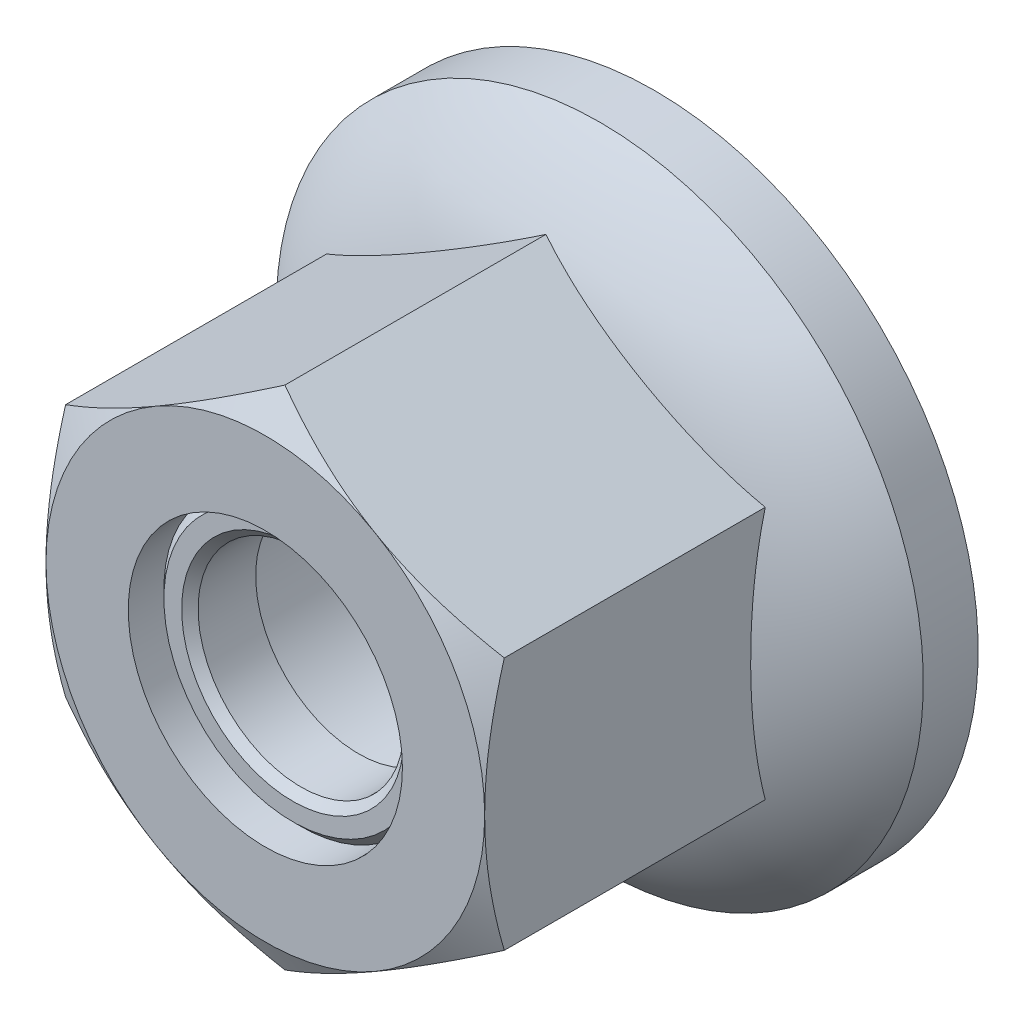
from build123d import *

# Parameters (mm, degrees)
SKETCH1_R           = 2.5
EXTRUDE1_DEPTH      = 7.1
SKETCH2_OUTSIDE_W   = 48.74
SKETCH2_OUTSIDE_H   = 49.978
SKETCH2_OUTSIDE_R   = 4
CUT_EXTRUDE1_DEPTH  = 10.36714115
CUT_EXTRUDE1_DRAFT  = -60
BOSS_EXTRUDE1_START = -0.5
SKETCH10_R          = 2.5
SKETCH10_R_2        = 1.876461709
BOSS_EXTRUDE1_DEPTH = 1.2
CHAMFER1_SIZE       = 0.15


with BuildPart() as part:
    # Sketch1 → Extrude1 (new body)
    with BuildSketch(Plane.XY):
        Polygon((0, 4.618802154), (-4, 2.309401077), (-4, -2.309401077), (0, -4.618802154), (4, -2.309401077), (4, 2.309401077), align=None)
        Circle(SKETCH1_R, mode=Mode.SUBTRACT)
    extrude(amount=-EXTRUDE1_DEPTH)


with BuildPart() as cut_extrude1_tool:
    # Sketch2 outside → Cut-Extrude1 (with draft: the straight prism first)
    with BuildSketch(Plane.XY):
        Rectangle(SKETCH2_OUTSIDE_W, SKETCH2_OUTSIDE_H)
        Circle(SKETCH2_OUTSIDE_R, mode=Mode.SUBTRACT)
    extrude(amount=-CUT_EXTRUDE1_DEPTH)
    # Cut-Extrude1: the draft: its side faces are tilted about the plane it starts from
    cut_extrude1_sides = [cut_extrude1_tool.faces().sort_by_distance(p)[0] for p in [
        (0, -24.989, -5.183570575),
        (24.37, 0, -5.183570575),
        (0, 24.989, -5.183570575),
        (-24.37, 0, -5.183570575),
        (-4, 0, -5.183570575),
    ]]
    draft(cut_extrude1_sides, Plane.XY, CUT_EXTRUDE1_DRAFT)


with BuildPart() as part_1:
    add(part.part)

    # Cut-Extrude1: cut by cut_extrude1_tool
    add(cut_extrude1_tool.part, mode=Mode.SUBTRACT)

    # Sketch3 → Revolve1 (revolve)
    with BuildSketch(Plane(origin=(0, 0, 0), x_dir=(0, 0, -1), z_dir=(1, 0, 0))):
        with BuildLine():
            Line((7.1, 5.9), (7.1, 2.5))
            Line((7.1, 2.5), (4.6, 2.5))
            ThreePointArc((4.6, 2.5), (4.99166172, 4.358090418), (6.1, 5.9))
            Line((6.1, 5.9), (7.1, 5.9))
        make_face()
    revolve(axis=Axis((0, 0, 0), (0, 0, -1)))


with BuildPart() as body_2:
    # Sketch10 → Boss-Extrude1 (new body)
    with BuildSketch(Plane.XY.offset(BOSS_EXTRUDE1_START)):
        Circle(SKETCH10_R)
        Circle(SKETCH10_R_2, mode=Mode.SUBTRACT)
    extrude(amount=-BOSS_EXTRUDE1_DEPTH)

    # Chamfer1
    chamfer1_edges = [body_2.edges().sort_by_distance(p)[0] for p in [
        (-2.5, 0, -0.5),
        (-1.876461709, 0, -0.5),
    ]]
    chamfer(chamfer1_edges, length=CHAMFER1_SIZE)


solid = Compound([part_1.part, body_2.part])
